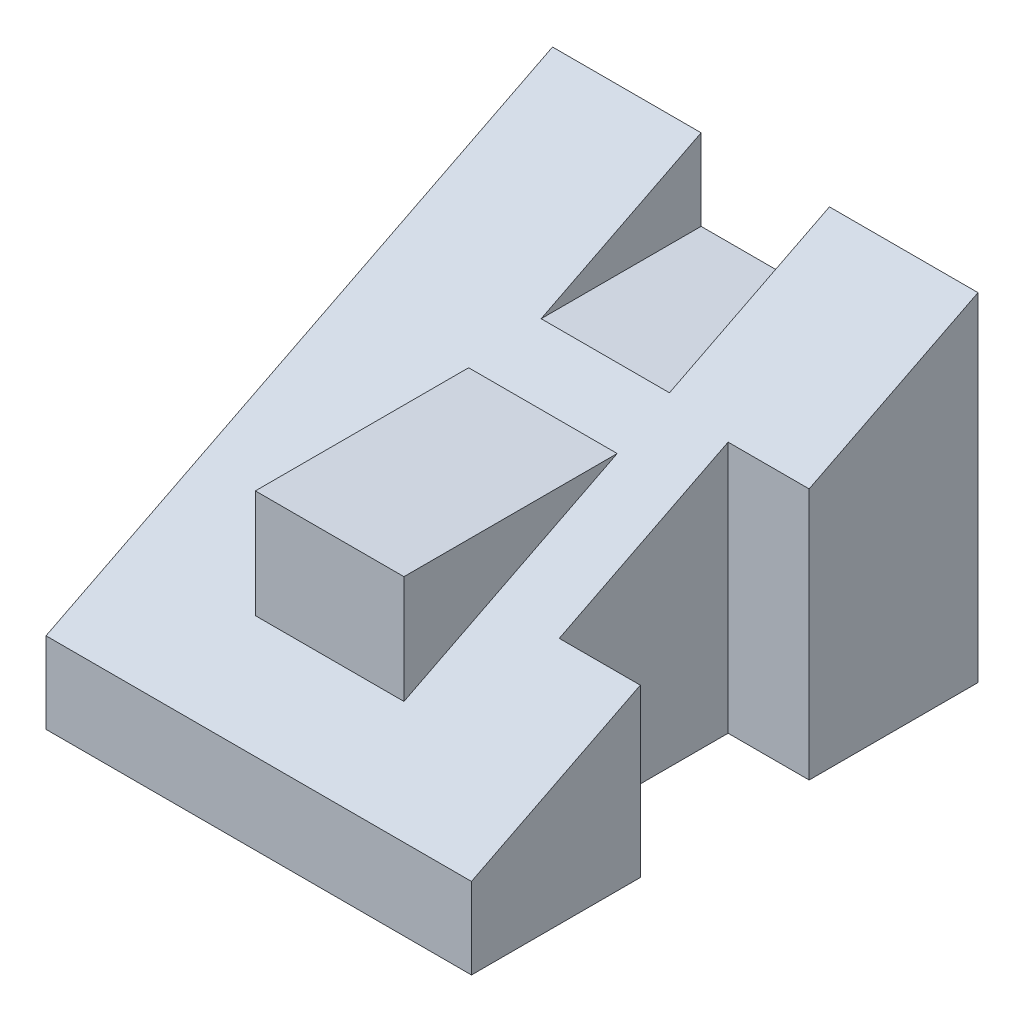
from build123d import *

# Parameters (mm, degrees)
BOSS_EXTRUDE1_DEPTH   = 63
BOSS_EXTRUDE1_2_DEPTH = 63
BOSS_EXTRUDE2_DEPTH   = 51
BOSS_EXTRUDE3_DEPTH   = 22
BOSS_EXTRUDE4_START   = 41
BOSS_EXTRUDE4_DEPTH   = 22
BOSS_EXTRUDE5_START   = 19
BOSS_EXTRUDE5_DEPTH   = 22


with BuildPart() as part:
    # Sketch1 → Boss-Extrude1 (new body)
    with BuildSketch(Plane(origin=(0, 0, 0), x_dir=(0, 0, -1), z_dir=(1, 0, 0))):
        Polygon((-25, 0), (0, 0), (0, 38), (-23.684210526, 38), (-25, 37.333333333), align=None)
    extrude(amount=BOSS_EXTRUDE1_DEPTH)



with BuildPart() as body_2:
    # Sketch1 → Boss-Extrude1 2 (new body)
    with BuildSketch(Plane(origin=(0, 0, 0), x_dir=(0, 0, -1), z_dir=(1, 0, 0))):
        Polygon((-75, 0), (-50, 0), (-50, 24.666666667), (-75, 12), align=None)
    extrude(amount=BOSS_EXTRUDE1_2_DEPTH)


with BuildPart() as part_1:
    add(part.part)

    add(body_2.part)  # Boss-Extrude2 merges body 2
    # Sketch1<3> → Boss-Extrude2 (add)
    with BuildSketch(Plane(origin=(0, 0, 0), x_dir=(0, 0, -1), z_dir=(1, 0, 0))):
        Polygon((-50, 0), (-25, 0), (-25, 37.333333333), (-31.421052632, 34.08), (-50, 24.666666667), align=None)
    extrude(amount=BOSS_EXTRUDE2_DEPTH)

    # Sketch1<4> → Boss-Extrude3 (add)
    with BuildSketch(Plane(origin=(0, 0, 0), x_dir=(0, 0, -1), z_dir=(1, 0, 0))):
        Polygon((-23.684210526, 38), (0, 38), (0, 50), align=None)
    extrude(amount=BOSS_EXTRUDE3_DEPTH)

    # Sketch1<5> → Boss-Extrude4 (add)
    with BuildSketch(Plane(origin=(0, 0, 0), x_dir=(0, 0, -1), z_dir=(1, 0, 0)).offset(BOSS_EXTRUDE4_START)):
        Polygon((-23.684210526, 38), (0, 38), (0, 50), align=None)
    extrude(amount=BOSS_EXTRUDE4_DEPTH)

    # Sketch1<6> → Boss-Extrude5 (add)
    with BuildSketch(Plane(origin=(0, 0, 0), x_dir=(0, 0, -1), z_dir=(1, 0, 0)).offset(BOSS_EXTRUDE5_START)):
        Polygon((-63, 18.08), (-50, 24.666666667), (-31.421052632, 34.08), (-63, 34.08), align=None)
    extrude(amount=BOSS_EXTRUDE5_DEPTH)


solid = part_1.part
